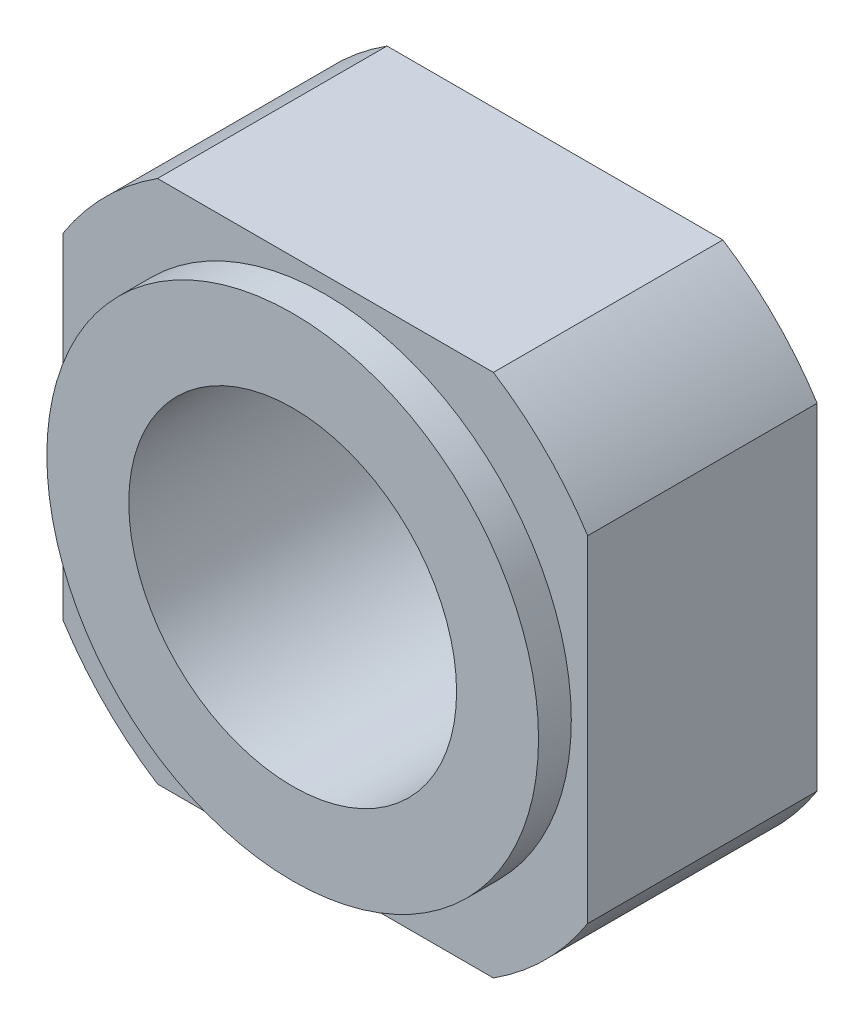
from build123d import *

# Parameters (mm, degrees)
SKIZZE1_R                       = 9.5
SKIZZE1_R_2                     = 5
AUFSATZ_LINEAR_AUSTRAGEN1_DEPTH = 8
SKIZZE2_OUTSIDE_W               = 26.608
SKIZZE2_OUTSIDE_H               = 26.608
SKIZZE2_OUTSIDE_W_2             = 16
SKIZZE2_OUTSIDE_H_2             = 16
SCHNITT_LINEAR_AUSTRAGEN1_DEPTH = 28
SKIZZE3_OUTSIDE_W               = 22.8
SKIZZE3_OUTSIDE_H               = 22.8
SKIZZE3_OUTSIDE_R               = 7.5
SCHNITT_LINEAR_AUSTRAGEN2_DEPTH = 1


with BuildPart() as part:
    # Skizze1 → Aufsatz-Linear austragen1 (new body)
    with BuildSketch(Plane.XY):
        Circle(SKIZZE1_R)
        Circle(SKIZZE1_R_2, mode=Mode.SUBTRACT)
    extrude(amount=AUFSATZ_LINEAR_AUSTRAGEN1_DEPTH)

    # Skizze2 outside → Schnitt-Linear austragen1 (cut)
    with BuildSketch(Plane(origin=(0, 0, 0), x_dir=(-1, 0, 0), z_dir=(0, 0, -1))):
        Rectangle(SKIZZE2_OUTSIDE_W, SKIZZE2_OUTSIDE_H)
        Rectangle(SKIZZE2_OUTSIDE_W_2, SKIZZE2_OUTSIDE_H_2, mode=Mode.SUBTRACT)
    extrude(amount=-SCHNITT_LINEAR_AUSTRAGEN1_DEPTH, mode=Mode.SUBTRACT)

    # Skizze3 outside → Schnitt-Linear austragen2 (cut)
    with BuildSketch(Plane.XY.offset(8)):
        Rectangle(SKIZZE3_OUTSIDE_W, SKIZZE3_OUTSIDE_H)
        Circle(SKIZZE3_OUTSIDE_R, mode=Mode.SUBTRACT)
    extrude(amount=-SCHNITT_LINEAR_AUSTRAGEN2_DEPTH, mode=Mode.SUBTRACT)


solid = part.part
